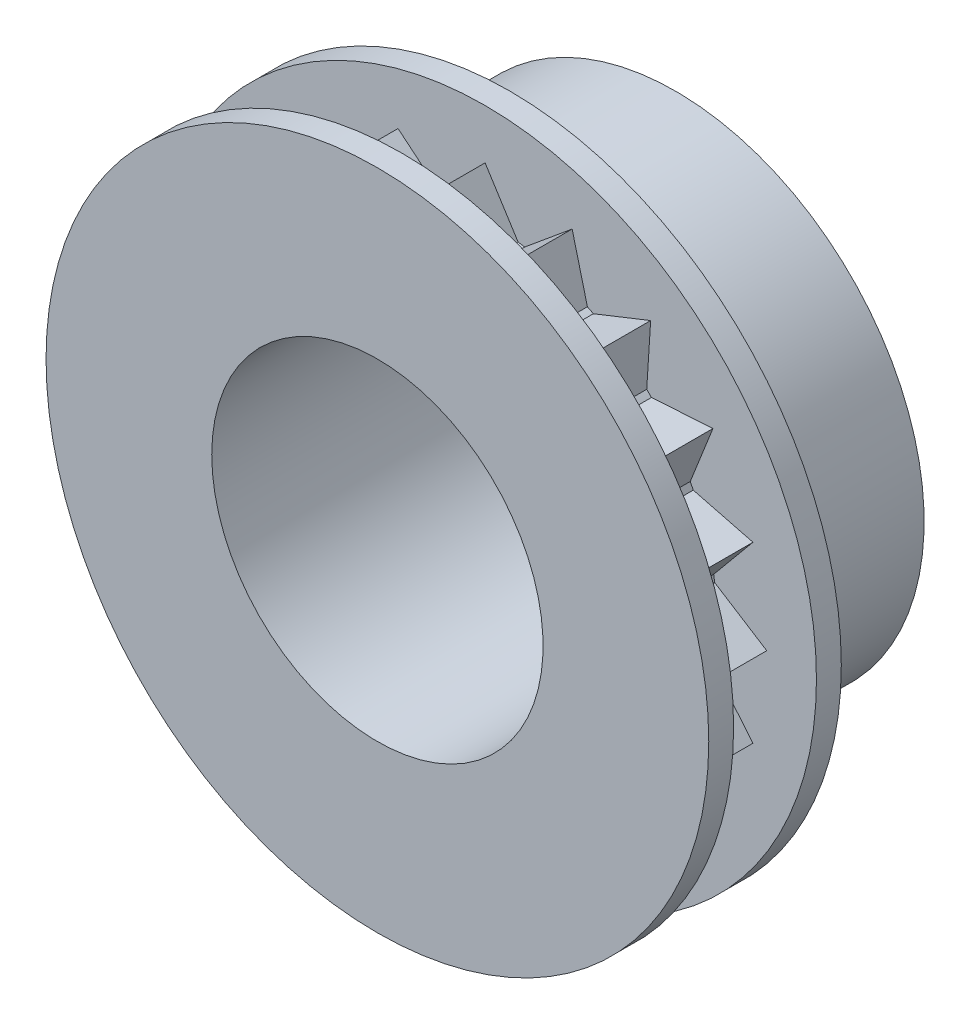
from build123d import *

# Parameters (mm, degrees)
BOSS_EXTRUDE1_DEPTH = 5
SKETCH2_R           = 20
BOSS_EXTRUDE2_DEPTH = 1.5
BOSS_EXTRUDE3_START = 1.5
SKETCH3_R           = 20
BOSS_EXTRUDE3_DEPTH = 1.5
SKETCH4_R           = 13
CUT_EXTRUDE1_DEPTH  = 11.5
SKETCH5_R           = 15
BOSS_EXTRUDE4_DEPTH = 10
CUT_EXTRUDE2_START  = -30
SKETCH6_R           = 13
CUT_EXTRUDE2_DEPTH  = 30
BOSS_EXTRUDE5_START = -18
SKETCH7_R           = 13
SKETCH7_R_2         = 10
BOSS_EXTRUDE5_DEPTH = 18


with BuildPart() as part:
    # Sketch1 → Boss-Extrude1 (new body)
    with BuildSketch(Plane.XY):
        with BuildLine():
            Line((0, 17), (-1.990617103, 13.857757522))
            ThreePointArc((-1.990617103, 13.857757522), (-2.190082511, 13.827636768), (-2.389093211, 13.794645107))
            Line((-2.389093211, 13.794645107), (-5.253288904, 16.167960777))
            Line((-5.253288904, 16.167960777), (-6.175471945, 12.564376079))
            ThreePointArc((-6.175471945, 12.564376079), (-6.355866996, 12.474091339), (-6.534942436, 12.381216715))
            Line((-6.534942436, 12.381216715), (-9.992349289, 13.753288904))
            Line((-9.992349289, 13.753288904), (-9.755828567, 10.041105964))
            ThreePointArc((-9.755828567, 10.041105964), (-9.899494937, 9.899494937), (-10.041105964, 9.755828567))
            Line((-10.041105964, 9.755828567), (-13.753288904, 9.992349289))
            Line((-13.753288904, 9.992349289), (-12.381216715, 6.534942436))
            ThreePointArc((-12.381216715, 6.534942436), (-12.474091339, 6.355866996), (-12.564376079, 6.175471945))
            Line((-12.564376079, 6.175471945), (-16.167960777, 5.253288904))
            Line((-16.167960777, 5.253288904), (-13.794645107, 2.389093211))
            ThreePointArc((-13.794645107, 2.389093211), (-13.827636768, 2.190082511), (-13.857757522, 1.990617103))
            Line((-13.857757522, 1.990617103), (-17, 0))
            Line((-17, 0), (-13.857757522, -1.990617103))
            ThreePointArc((-13.857757522, -1.990617103), (-13.827636768, -2.190082511), (-13.794645107, -2.389093211))
            Line((-13.794645107, -2.389093211), (-16.167960777, -5.253288904))
            Line((-16.167960777, -5.253288904), (-12.564376079, -6.175471945))
            ThreePointArc((-12.564376079, -6.175471945), (-12.474091339, -6.355866996), (-12.381216715, -6.534942436))
            Line((-12.381216715, -6.534942436), (-13.753288904, -9.992349289))
            Line((-13.753288904, -9.992349289), (-10.041105964, -9.755828567))
            ThreePointArc((-10.041105964, -9.755828567), (-9.899494937, -9.899494937), (-9.755828567, -10.041105964))
            Line((-9.755828567, -10.041105964), (-9.992349289, -13.753288904))
            Line((-9.992349289, -13.753288904), (-6.534942436, -12.381216715))
            ThreePointArc((-6.534942436, -12.381216715), (-6.355866996, -12.474091339), (-6.175471945, -12.564376079))
            Line((-6.175471945, -12.564376079), (-5.253288904, -16.167960777))
            Line((-5.253288904, -16.167960777), (-2.389093211, -13.794645107))
            ThreePointArc((-2.389093211, -13.794645107), (-2.190082511, -13.827636768), (-1.990617103, -13.857757522))
            Line((-1.990617103, -13.857757522), (0, -17))
            Line((0, -17), (1.990617103, -13.857757522))
            ThreePointArc((1.990617103, -13.857757522), (2.190082511, -13.827636768), (2.389093211, -13.794645107))
            Line((2.389093211, -13.794645107), (5.253288904, -16.167960777))
            Line((5.253288904, -16.167960777), (6.175471945, -12.564376079))
            ThreePointArc((6.175471945, -12.564376079), (6.355866996, -12.474091339), (6.534942436, -12.381216715))
            Line((6.534942436, -12.381216715), (9.992349289, -13.753288904))
            Line((9.992349289, -13.753288904), (9.755828567, -10.041105964))
            ThreePointArc((9.755828567, -10.041105964), (9.899494937, -9.899494937), (10.041105964, -9.755828567))
            Line((10.041105964, -9.755828567), (13.753288904, -9.992349289))
            Line((13.753288904, -9.992349289), (12.381216715, -6.534942436))
            ThreePointArc((12.381216715, -6.534942436), (12.474091339, -6.355866996), (12.564376079, -6.175471945))
            Line((12.564376079, -6.175471945), (16.167960777, -5.253288904))
            Line((16.167960777, -5.253288904), (13.794645107, -2.389093211))
            ThreePointArc((13.794645107, -2.389093211), (13.827636768, -2.190082511), (13.857757522, -1.990617103))
            Line((13.857757522, -1.990617103), (17, 0))
            Line((17, 0), (13.857757522, 1.990617103))
            ThreePointArc((13.857757522, 1.990617103), (13.827636768, 2.190082511), (13.794645107, 2.389093211))
            Line((13.794645107, 2.389093211), (16.167960777, 5.253288904))
            Line((16.167960777, 5.253288904), (12.564376079, 6.175471945))
            ThreePointArc((12.564376079, 6.175471945), (12.474091339, 6.355866996), (12.381216715, 6.534942436))
            Line((12.381216715, 6.534942436), (13.753288904, 9.992349289))
            Line((13.753288904, 9.992349289), (10.041105964, 9.755828567))
            ThreePointArc((10.041105964, 9.755828567), (9.899494937, 9.899494937), (9.755828567, 10.041105964))
            Line((9.755828567, 10.041105964), (9.992349289, 13.753288904))
            Line((9.992349289, 13.753288904), (6.534942436, 12.381216715))
            ThreePointArc((6.534942436, 12.381216715), (6.355866996, 12.474091339), (6.175471945, 12.564376079))
            Line((6.175471945, 12.564376079), (5.253288904, 16.167960777))
            Line((5.253288904, 16.167960777), (2.389093211, 13.794645107))
            ThreePointArc((2.389093211, 13.794645107), (2.190082511, 13.827636768), (1.990617103, 13.857757522))
            Line((1.990617103, 13.857757522), (0, 17))
        make_face()
    extrude(amount=BOSS_EXTRUDE1_DEPTH)

    # Sketch2 → Boss-Extrude2 (add)
    with BuildSketch(Plane(origin=(0, 0, 0), x_dir=(-1, 0, 0), z_dir=(0, 0, -1))):
        Circle(SKETCH2_R)
    extrude(amount=BOSS_EXTRUDE2_DEPTH)

    # Sketch3 → Boss-Extrude3 (add)
    with BuildSketch(Plane.XY.offset(5).offset(BOSS_EXTRUDE3_START)):
        with Locations(Location((0, 0, 0), (0, 0, 180))):
            Circle(SKETCH3_R)
    extrude(amount=-BOSS_EXTRUDE3_DEPTH)

    # Sketch4 → Cut-Extrude1 (cut)
    with BuildSketch(Plane.XY.offset(6.5)):
        Circle(SKETCH4_R)
    extrude(amount=-CUT_EXTRUDE1_DEPTH, mode=Mode.SUBTRACT)

    # Sketch5 → Boss-Extrude4 (add)
    with BuildSketch(Plane(origin=(0, 0, -1.5), x_dir=(-1, 0, 0), z_dir=(0, 0, -1))):
        Circle(SKETCH5_R)
    extrude(amount=BOSS_EXTRUDE4_DEPTH)

    # Sketch6 → Cut-Extrude2 (cut)
    with BuildSketch(Plane(origin=(0, 0, -11.5), x_dir=(-1, 0, 0), z_dir=(0, 0, -1)).offset(CUT_EXTRUDE2_START)):
        with Locations(Location((0, 0, 0), (0, 0, 180))):
            Circle(SKETCH6_R)
    extrude(amount=CUT_EXTRUDE2_DEPTH, mode=Mode.SUBTRACT)

    # Sketch7 → Boss-Extrude5 (add)
    with BuildSketch(Plane(origin=(0, 0, -11.5), x_dir=(-1, 0, 0), z_dir=(0, 0, -1)).offset(BOSS_EXTRUDE5_START)):
        Circle(SKETCH7_R)
        Circle(SKETCH7_R_2, mode=Mode.SUBTRACT)
    extrude(amount=BOSS_EXTRUDE5_DEPTH)


solid = part.part
